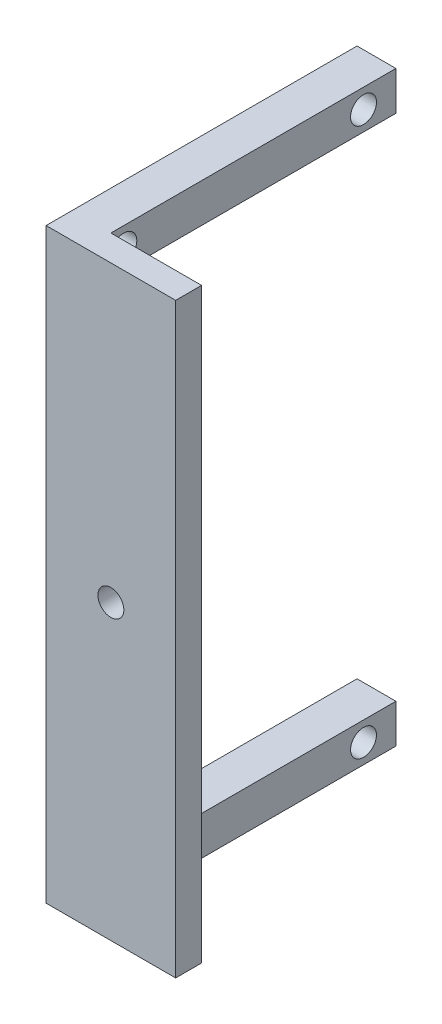
from build123d import *

# Parameters (mm, degrees)
SKETCH1_W           = 10
SKETCH1_H           = 45.3
BOSS_EXTRUDE2_DEPTH = 2
SKETCH2_W           = 3
SKETCH2_H           = 3
BOSS_EXTRUDE3_DEPTH = 22
SKETCH3_R           = 1
CUT_EXTRUDE1_DEPTH  = 22
SKETCH4_R           = 1
CUT_EXTRUDE2_DEPTH  = 22


with BuildPart() as part:
    # Sketch1 → Boss-Extrude2 (new body)
    with BuildSketch(Plane.XY):
        with Locations((2.593477414, 6.123019747)):
            Rectangle(SKETCH1_W, SKETCH1_H)
    extrude(amount=BOSS_EXTRUDE2_DEPTH)

    # Sketch2 → Boss-Extrude3 (add)
    with BuildSketch(Plane(origin=(0, 0, 0), x_dir=(-1, 0, 0), z_dir=(0, 0, -1))):
        with Locations((0.906522586, 27.273019747)):
            Rectangle(SKETCH2_W, SKETCH2_H)
        with Locations((0.906522586, -15.026980253)):
            Rectangle(SKETCH2_W, SKETCH2_H)
    extrude(amount=BOSS_EXTRUDE3_DEPTH)

    # Sketch3 → Cut-Extrude1 (cut)
    with BuildSketch(Plane.ZY.offset(2.406522586)):
        with Locations((-19.5, 27.273019747)):
            Circle(SKETCH3_R)
        with Locations((-1, 27.273019747)):
            Circle(SKETCH3_R)
        with Locations((-1, -15.026980253)):
            Circle(SKETCH3_R)
        with Locations((-19.5, -15.026980253)):
            Circle(SKETCH3_R)
    extrude(amount=-CUT_EXTRUDE1_DEPTH, mode=Mode.SUBTRACT)

    # Sketch4 → Cut-Extrude2 (cut)
    with BuildSketch(Plane(origin=(0, 0, 0), x_dir=(-1, 0, 0), z_dir=(0, 0, -1))):
        with Locations((-2.593477414, 6.073019747)):
            Circle(SKETCH4_R)
    extrude(amount=-CUT_EXTRUDE2_DEPTH, mode=Mode.SUBTRACT)


solid = part.part
